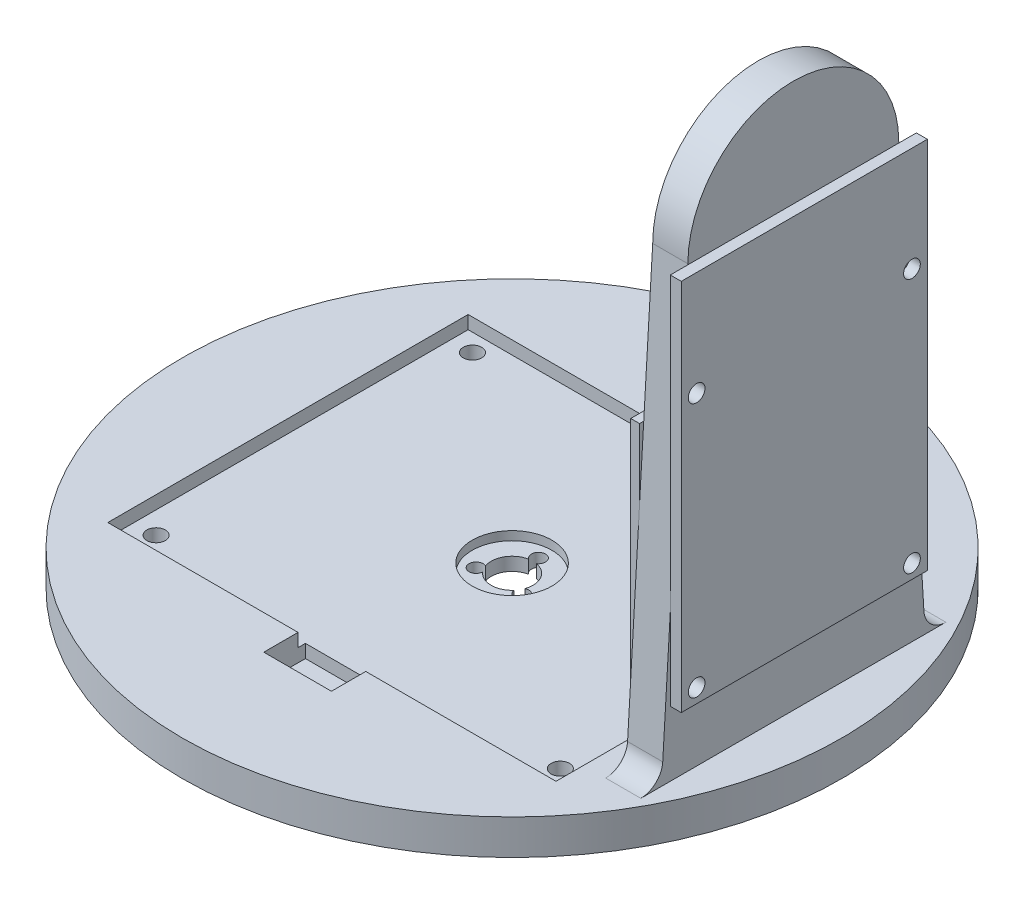
from build123d import *

# Parameters (mm, degrees)
SKETCH_1_R           = 75
EXTRUDE_2_DEPTH      = 8
SKETCH_1_6_W         = 102
SKETCH_1_6_H         = 82
CUT_EXTRUDE_3_DEPTH  = 3
SKETCH_2_R           = 9.065
CUT_EXTRUDE_4_DEPTH  = 2
SKETCH_3_R           = 1.6
CUT_EXTRUDE_5_DEPTH  = 10
SKETCH_11_R          = 4.755489011
CUT_EXTRUDE_6_DEPTH  = 10
SKETCH_12_R          = 2.1
CUT_EXTRUDE_7_DEPTH  = 10
SKETCH_21_W          = 15.39960192
SKETCH_21_H          = 9.476678105
CUT_EXTRUDE_8_DEPTH  = 6
EXTRUDE_5_DEPTH      = 8
SKETCH_30_W          = 56
SKETCH_30_H          = 85
EXTRUDE_6_DEPTH      = 2.5
SKETCH_31_R          = 1.9
CUT_EXTRUDE_10_DEPTH = 3.5
FILLET_1_R           = 5
SKETCH_40_W          = 52
SKETCH_40_H          = 52
EXTRUDE_7_DEPTH      = 2
SKETCH_42_R          = 1.9
CUT_EXTRUDE_11_DEPTH = 3.5
SKETCH_52_R          = 2.1
CUT_EXTRUDE_12_DEPTH = 4


with BuildPart() as part:
    # 草图1 → 凸台-拉伸2 (new body)
    with BuildSketch(Plane(origin=(0, 0, 0), x_dir=(1, 0, 0), z_dir=(0, 1, 0))):
        Circle(SKETCH_1_R)
    extrude(amount=-EXTRUDE_2_DEPTH)

    # 草图1<6> → 切除-拉伸3 (cut)
    with BuildSketch(Plane(origin=(0, 0, 0), x_dir=(1, 0, 0), z_dir=(0, 1, 0))):
        Rectangle(SKETCH_1_6_W, SKETCH_1_6_H)
    extrude(amount=-CUT_EXTRUDE_3_DEPTH, mode=Mode.SUBTRACT)

    # 草图2 → 切除-拉伸4 (cut)
    with BuildSketch(Plane(origin=(0, -3, 0), x_dir=(1, 0, 0), z_dir=(0, 1, 0))):
        Circle(SKETCH_2_R)
    extrude(amount=-CUT_EXTRUDE_4_DEPTH, mode=Mode.SUBTRACT)

    # 草图3 → 切除-拉伸5 (cut)
    with BuildSketch(Plane(origin=(0, -5, 0), x_dir=(1, 0, 0), z_dir=(0, 1, 0))):
        with Locations((0, 6)):
            Circle(SKETCH_3_R)
        with Locations((5.196152423, -3)):
            Circle(SKETCH_3_R)
        with Locations((-5.196152423, -3)):
            Circle(SKETCH_3_R)
    extrude(amount=-CUT_EXTRUDE_5_DEPTH, mode=Mode.SUBTRACT)

    # 草图11 → 切除-拉伸6 (cut)
    with BuildSketch(Plane(origin=(0, -5, 0), x_dir=(1, 0, 0), z_dir=(0, 1, 0))):
        Circle(SKETCH_11_R)
    extrude(amount=-CUT_EXTRUDE_6_DEPTH, mode=Mode.SUBTRACT)

    # 草图12 → 切除-拉伸7 (cut)
    with BuildSketch(Plane(origin=(0, -3, 0), x_dir=(1, 0, 0), z_dir=(0, 1, 0))):
        with Locations((-46, 36.980392157)):
            Circle(SKETCH_12_R)
        with Locations((46, 36.980392157)):
            Circle(SKETCH_12_R)
        with Locations((46, -35.019607843)):
            Circle(SKETCH_12_R)
        with Locations((-46, -35.019607843)):
            Circle(SKETCH_12_R)
    extrude(amount=-CUT_EXTRUDE_7_DEPTH, mode=Mode.SUBTRACT)

    # 草图21 → 切除-拉伸8 (cut)
    with BuildSketch(Plane(origin=(0, 0, 0), x_dir=(1, 0, 0), z_dir=(0, 1, 0))):
        with Locations((0, -44.066553185)):
            Rectangle(SKETCH_21_W, SKETCH_21_H)
    extrude(amount=-CUT_EXTRUDE_8_DEPTH, mode=Mode.SUBTRACT)

    # 草图24 → 凸台-拉伸5 (add)
    with BuildSketch(Plane.ZY.offset(-64)):
        with BuildLine():
            Line((-24, 100), (-30, 0))
            Line((-30, 0), (30, 0))
            Line((30, 0), (24, 100))
            ThreePointArc((24, 100), (0, 124), (-24, 100))
        make_face()
    extrude(amount=EXTRUDE_5_DEPTH)

    # 草图30 → 凸台-拉伸6 (add)
    with BuildSketch(Plane(origin=(64, 0, 0), x_dir=(0, 0, -1), z_dir=(1, 0, 0))):
        with Locations((0, 57.284476884)):
            Rectangle(SKETCH_30_W, SKETCH_30_H)
    extrude(amount=EXTRUDE_6_DEPTH)

    # 草图31 → 切除-拉伸10 (cut)
    with BuildSketch(Plane(origin=(66.5, 0, 0), x_dir=(0, 0, -1), z_dir=(1, 0, 0))):
        with Locations((-24.5, 18)):
            Circle(SKETCH_31_R)
        with Locations((24.5, 18)):
            Circle(SKETCH_31_R)
        with Locations((24.5, 76)):
            Circle(SKETCH_31_R)
        with Locations((-24.5, 76)):
            Circle(SKETCH_31_R)
    extrude(amount=-CUT_EXTRUDE_10_DEPTH, mode=Mode.SUBTRACT)

    # 圆角1
    fillet_1_edges = [part.edges().sort_by_distance(p)[0] for p in [
        (60, 0, 30),
        (60, 0, -30),
    ]]
    fillet(fillet_1_edges, radius=FILLET_1_R)

    # 草图40 → 凸台-拉伸7 (add)
    with BuildSketch(Plane.ZY.offset(-56)):
        with Locations((1, 40.006516634)):
            Rectangle(SKETCH_40_W, SKETCH_40_H)
    extrude(amount=EXTRUDE_7_DEPTH)

    # 草图42 → 切除-拉伸11 (cut)
    with BuildSketch(Plane.ZY.offset(-54)):
        with Locations((-22.2, 63.206516634)):
            Circle(SKETCH_42_R)
        with Locations((24.2, 63.206516634)):
            Circle(SKETCH_42_R)
        with Locations((-22.2, 16.806516634)):
            Circle(SKETCH_42_R)
        with Locations((24.2, 16.806516634)):
            Circle(SKETCH_42_R)
    extrude(amount=-CUT_EXTRUDE_11_DEPTH, mode=Mode.SUBTRACT)

    # 草图52 → 切除-拉伸12 (cut)
    with BuildSketch(Plane.ZY.offset(-56)):
        with Locations((10.606601718, 110.606601718)):
            Circle(SKETCH_52_R)
        with Locations((10.606601718, 89.393398282)):
            Circle(SKETCH_52_R)
        with Locations((-10.606601718, 89.393398282)):
            Circle(SKETCH_52_R)
        with Locations((-10.606601718, 110.606601718)):
            Circle(SKETCH_52_R)
    extrude(amount=-CUT_EXTRUDE_12_DEPTH, mode=Mode.SUBTRACT)


solid = part.part
